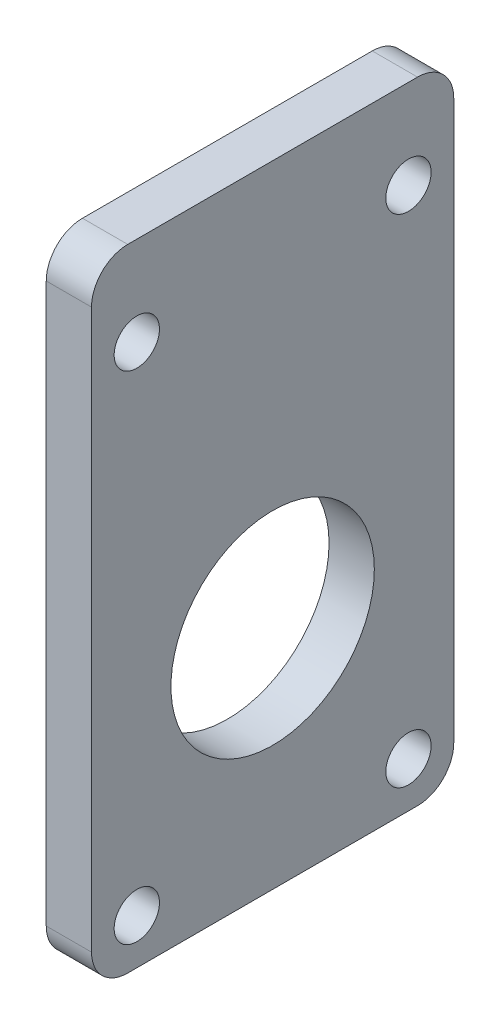
from build123d import *

# Parameters (mm, degrees)
SKETCH1_W                   = 50.8
SKETCH1_H                   = 88.500000038
SKETCH1_R                   = 14.2621
BOSS_EXTRUDE1_DEPTH         = 3.175
FILLET1_R                   = 5.08
F_1_4_0_25_DIAMETER_HOLE2_D = 6.35


with BuildPart() as part:
    # Sketch1 → Boss-Extrude1 (new, symmetric)
    with BuildSketch(Plane(origin=(0, 0, 0), x_dir=(0, 0, -1), z_dir=(1, 0, 0))):
        Rectangle(SKETCH1_W, SKETCH1_H)
        with Locations((0, -12.500000019)):
            Circle(SKETCH1_R, mode=Mode.SUBTRACT)
    extrude(amount=BOSS_EXTRUDE1_DEPTH, both=True)

    # Fillet1
    fillet1_edges = [part.edges().sort_by_distance(p)[0] for p in [
        (0, -44.250000019, -25.4),
        (0, -44.250000019, 25.4),
        (0, 44.250000019, 25.4),
        (0, 44.250000019, -25.4),
    ]]
    fillet(fillet1_edges, radius=FILLET1_R)

    # 1/4 (0.25) Diameter Hole2 (through all)
    with Locations(Plane(origin=(3.175, -37.900000019, 19.05), x_dir=(0, 0, 1), z_dir=(1, 0, 0))):
        with Locations((0, 0), (-38.1, 0), (0, -69.650000038), (-38.1, -69.650000038)):
            Hole(F_1_4_0_25_DIAMETER_HOLE2_D / 2)


solid = part.part
